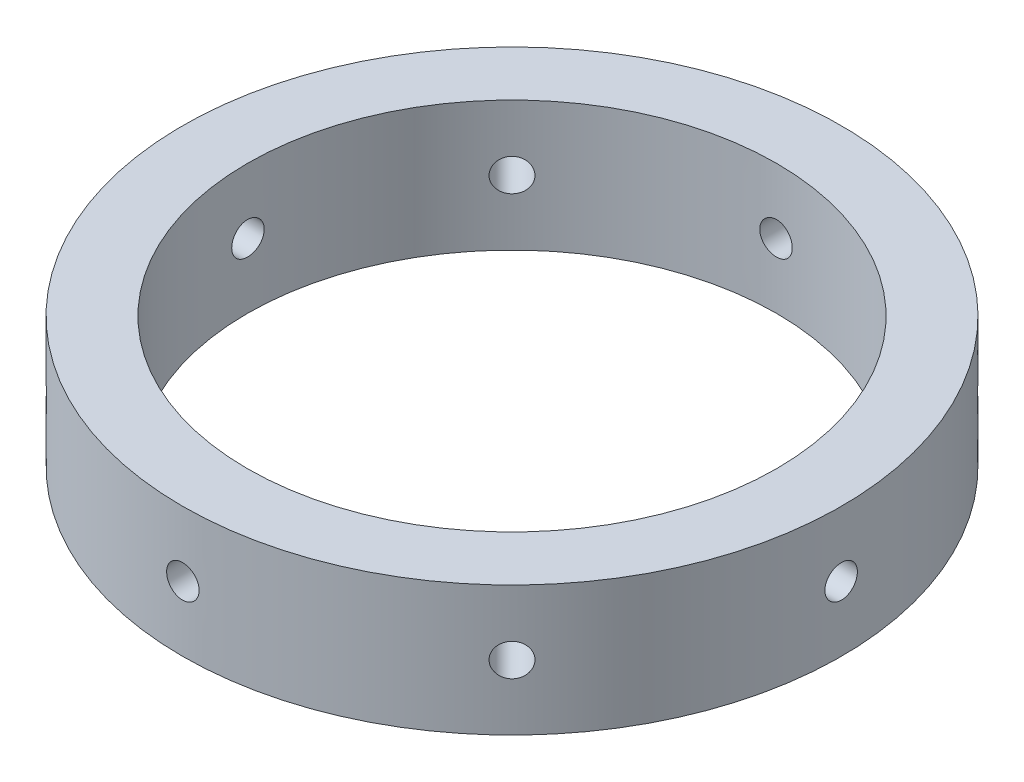
from build123d import *

# Parameters (mm, degrees)
SKETCH3_R               = 50.7
SKETCH3_R_2             = 40.700000007
BOSS_EXTRUDE1_DEPTH     = 20
CUT_EXTRUDE1_REACH      = 117.119
CUT_EXTRUDE1_END_RADIUS = 40.700000007
SKETCH5_R               = 2.5
CIRPATTERN1_COUNT       = 8


with BuildPart() as part:
    # Sketch3 → Boss-Extrude1 (new body)
    with BuildSketch(Plane(origin=(0, 0, 0), x_dir=(1, 0, 0), z_dir=(0, 1, 0))):
        with Locations(Location((0, 0, 0), (0, 0, 270))):
            Circle(SKETCH3_R)
        with Locations(Location((0, 0, 0), (0, 0, 270))):
            Circle(SKETCH3_R_2, mode=Mode.SUBTRACT)
    extrude(amount=BOSS_EXTRUDE1_DEPTH)

    # Cut-Extrude1: up to this cylinder (the profile starts outside it)
    cut_extrude1_end = Plane(origin=(0, 10, 0), z_dir=(0, -1, 0)) * Cylinder(CUT_EXTRUDE1_END_RADIUS, 316.638000014, mode=Mode.PRIVATE)
    # Sketch5 → Cut-Extrude1 (cut, up to the surface)
    with BuildSketch(Plane(origin=(50.7, 0, 0), x_dir=(0, 0, -1), z_dir=(1, 0, 0)), mode=Mode.PRIVATE) as cut_extrude1_sk1:
        with Locations((0, 10)):
            Circle(SKETCH5_R)
    cut_extrude1_tool1 = extrude(cut_extrude1_sk1.sketch, amount=-CUT_EXTRUDE1_REACH, mode=Mode.PRIVATE) - cut_extrude1_end
    cut_extrude1 = cut_extrude1_tool1.solids().sort_by_distance((50.7, 10, 0))[0]
    add(cut_extrude1, mode=Mode.SUBTRACT)

    # CirPattern1: Cut-Extrude1 ×8 about axis
    cirpattern1_axis = Axis((0, 20, 0), (0, -1, 0))
    for i in range(1, CIRPATTERN1_COUNT):
        add(cut_extrude1.rotate(cirpattern1_axis, i * 360 / CIRPATTERN1_COUNT), mode=Mode.SUBTRACT)


solid = part.part
